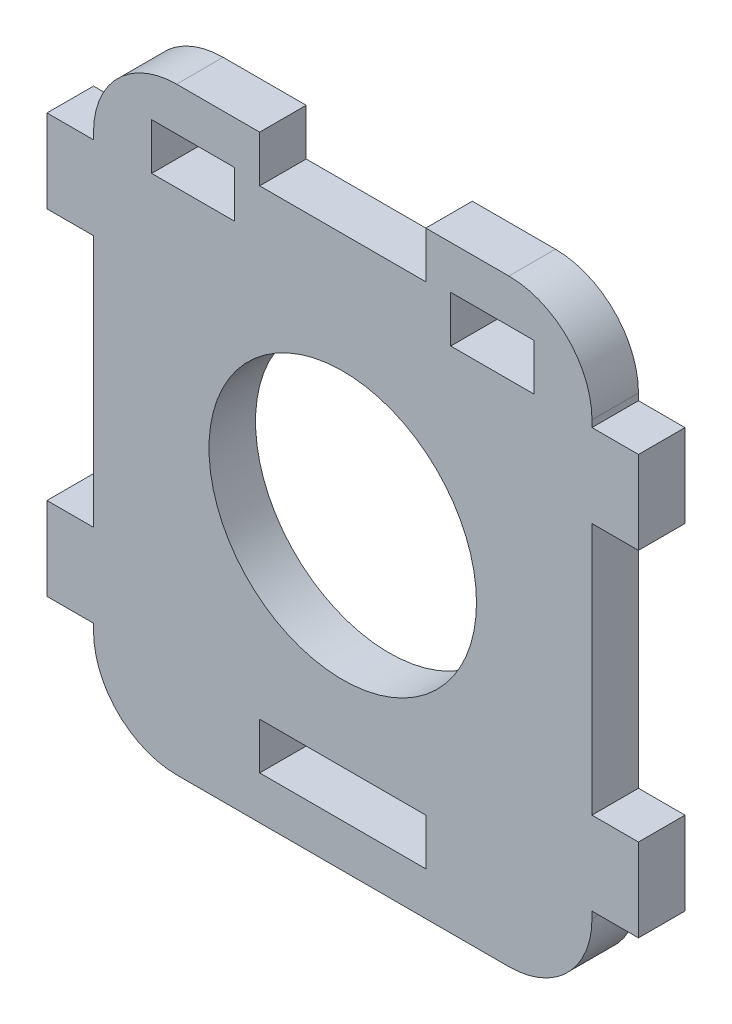
from build123d import *

# Parameters (mm, degrees)
SKETCH_1_R      = 8.05
SKETCH_1_W      = 10
SKETCH_1_H      = 2.8
SKETCH_1_W_2    = 5
EXTRUDE_1_DEPTH = 1.4
FILLET_1_R      = 5


with BuildPart() as part:
    # Эскиз1 → Бобышка-Вытянуть1 (new, symmetric)
    with BuildSketch(Plane.XY):
        Polygon((-15, 12.6), (-17.8, 12.6), (-17.8, 7.6), (-15, 7.6), (-15, -7.6), (-17.8, -7.6), (-17.8, -12.6), (-15, -12.6), (-15, -18), (15, -18), (15, -12.6), (17.8, -12.6), (17.8, -7.6), (15, -7.6), (15, 7.6), (17.8, 7.6), (17.8, 12.6), (15, 12.6), (15, 18), (5, 18), (5, 15.2), (-5, 15.2), (-5, 18), (-15, 18), align=None)
        Circle(SKETCH_1_R, mode=Mode.SUBTRACT)
        with Locations((0, -14)):
            Rectangle(SKETCH_1_W, SKETCH_1_H, mode=Mode.SUBTRACT)
        with Locations((9, 14)):
            Rectangle(SKETCH_1_W_2, SKETCH_1_H, mode=Mode.SUBTRACT)
        with Locations((-9, 14)):
            Rectangle(SKETCH_1_W_2, SKETCH_1_H, mode=Mode.SUBTRACT)
    extrude(amount=EXTRUDE_1_DEPTH, both=True)

    # Скругление1
    fillet_1_edges = [part.edges().sort_by_distance(p)[0] for p in [
        (15, 18, 0),
        (15, -18, 0),
        (-15, -18, 0),
        (-15, 18, 0),
    ]]
    fillet(fillet_1_edges, radius=FILLET_1_R)


solid = part.part
